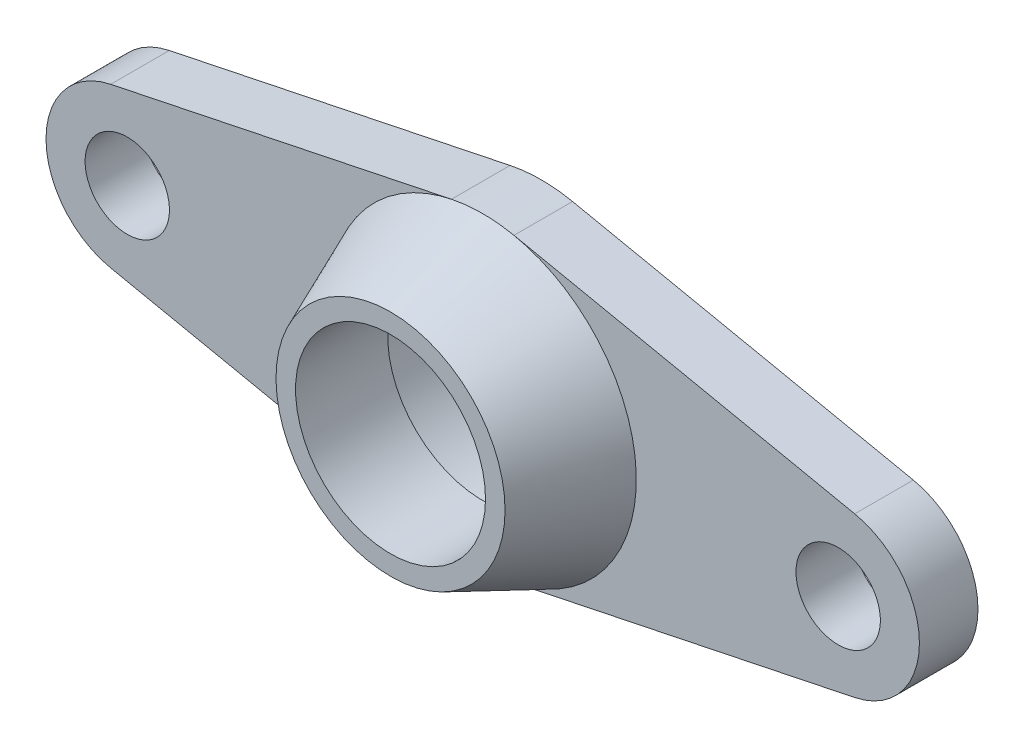
from build123d import *

# Parameters (mm, degrees)
SKETCH1_R           = 6.604
SKETCH1_R_2         = 3.429
SKETCH1_R_3         = 12.4841
SKETCH1_R_4         = 9.3091
BOSS_EXTRUDE1_DEPTH = 4.7625
SKETCH3_R           = 12.4841
SKETCH2_R           = 9.3091
SKETCH5_R           = 7.7216
CUT_EXTRUDE1_DEPTH  = 40.575251945


with BuildPart() as part:
    # Sketch1 → Boss-Extrude1 (new body)
    # profile 1 of 5: a face of its own
    with BuildSketch(Plane.XY):
        with Locations((-28.894599, 0)):
            Circle(SKETCH1_R)
        with Locations(Location((-28.894599, 0, 0), (0, 0, 180))):
            Circle(SKETCH1_R_2, mode=Mode.SUBTRACT)
    # profile 2 of 5: a face of its own
    with BuildSketch(Plane.XY):
        with BuildLine():
            Line((-2.540535565, 12.222865124), (-30.238524223, 6.465808611))
            ThreePointArc((-30.238524223, 6.465808611), (-24.727013738, 5.1228946), (-22.290599, 0))
            ThreePointArc((-22.290599, 0), (-24.727013738, -5.1228946), (-30.238524223, -6.465808611))
            Line((-30.238524223, -6.465808611), (-2.540535565, -12.222865124))
            ThreePointArc((-2.540535565, -12.222865124), (-12.4841, 0), (-2.540535565, 12.222865124))
        make_face()
    # profile 3 of 5: a face of its own
    with BuildSketch(Plane.XY):
        Circle(SKETCH1_R_3)
        with Locations(Location((0, 0, 0), (0, 0, 180))):
            Circle(SKETCH1_R_4, mode=Mode.SUBTRACT)
    # profile 4 of 5: a face of its own
    with BuildSketch(Plane.XY):
        with BuildLine():
            Line((30.238524223, 6.465808611), (2.540535565, 12.222865124))
            ThreePointArc((2.540535565, 12.222865124), (9.684241139, 7.878339062), (12.4841, 0))
            ThreePointArc((12.4841, 0), (9.684241139, -7.878339062), (2.540535565, -12.222865124))
            Line((2.540535565, -12.222865124), (30.238524223, -6.465808611))
            ThreePointArc((30.238524223, -6.465808611), (22.290599, 0), (30.238524223, 6.465808611))
        make_face()
    # profile 5 of 5: a face of its own
    with BuildSketch(Plane.XY):
        with Locations((28.894599, 0)):
            Circle(SKETCH1_R)
        with Locations(Location((28.894599, 0, 0), (0, 0, 180))):
            Circle(SKETCH1_R_2, mode=Mode.SUBTRACT)
    extrude(amount=BOSS_EXTRUDE1_DEPTH)

    # Sketch3 → Loft3 section 0
    with BuildSketch(Plane.XY.offset(4.7625)):
        Circle(SKETCH3_R)
    # Sketch2 → Loft3 section 1
    with BuildSketch(Plane.XY.offset(12.2555)):
        Circle(SKETCH2_R)
    loft()

    # Sketch5 → Cut-Extrude1 (cut, through all)
    with BuildSketch(Plane.XY.offset(12.2555)):
        Circle(SKETCH5_R)
    extrude(amount=-CUT_EXTRUDE1_DEPTH, mode=Mode.SUBTRACT)


solid = part.part
